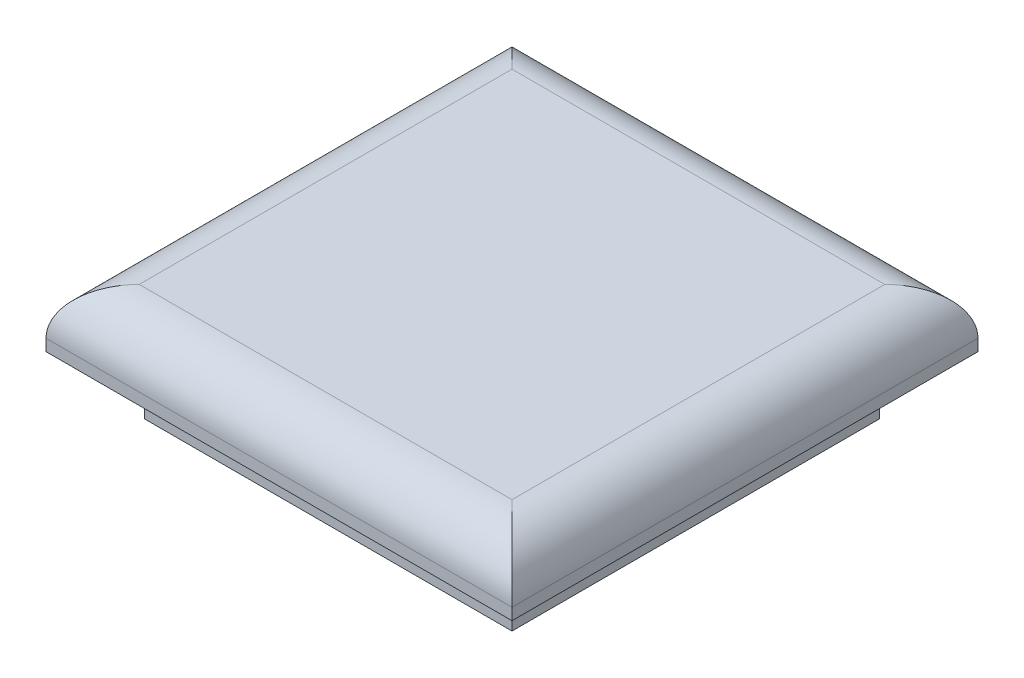
from build123d import *

# Parameters (mm, degrees)
SKETCH2_W           = 20.028
SKETCH2_H           = 20.028
SKETCH2_W_2         = 13.678
SKETCH2_H_2         = 13.678
BOSS_EXTRUDE2_DEPTH = 3.175
SKETCH2_3_W         = 25.4
SKETCH2_3_H         = 25.4
BOSS_EXTRUDE3_DEPTH = 3.175
FILLET1_R           = 2.54
CUT_EXTRUDE1_DEPTH  = 33.278974844


with BuildPart() as part:
    # Sketch2 → Boss-Extrude2 (new body)
    with BuildSketch(Plane(origin=(0, 0, 0), x_dir=(1, 0, 0), z_dir=(0, 1, 0))):
        with Locations((10.014, 10.014)):
            Rectangle(SKETCH2_W, SKETCH2_H)
        with Locations((10.014, 10.014)):
            Rectangle(SKETCH2_W_2, SKETCH2_H_2, mode=Mode.SUBTRACT)
    extrude(amount=-BOSS_EXTRUDE2_DEPTH)

    # Sketch2<3> → Boss-Extrude3 (add)
    with BuildSketch(Plane(origin=(0, 0, 0), x_dir=(1, 0, 0), z_dir=(0, 1, 0))):
        with Locations((10.014, 10.014)):
            Rectangle(SKETCH2_3_W, SKETCH2_3_H)
    extrude(amount=BOSS_EXTRUDE3_DEPTH)

    # Fillet1
    fillet1_edges = [part.edges().sort_by_distance(p)[0] for p in [
        (10.014, 3.175, -22.714),
        (22.714, 3.175, -10.014),
        (10.014, 3.175, 2.686),
        (-2.686, 3.175, -10.014),
    ]]
    fillet(fillet1_edges, radius=FILLET1_R)

    # Sketch3 → Cut-Extrude1 (cut, through all)
    with BuildSketch(Plane.XY):
        Polygon((0, -0.4), (0.4, 0), (0, 0), align=None)
        Polygon((20.028, -0.4), (19.628, 0), (20.028, 0), align=None)
    extrude(amount=-CUT_EXTRUDE1_DEPTH, mode=Mode.SUBTRACT)


solid = part.part
